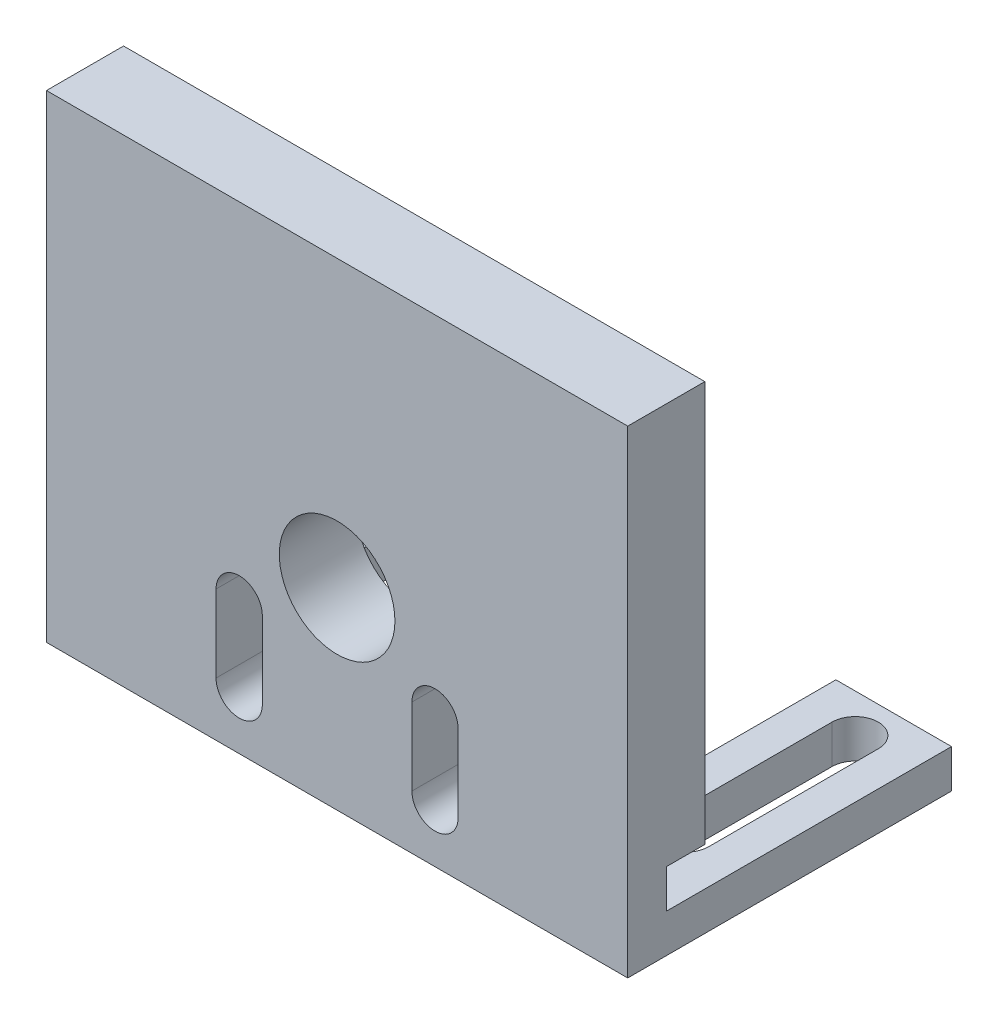
from build123d import *

# Parameters (mm, degrees)
SKETCH1_W           = 75.4
SKETCH1_H           = 62
SKETCH1_R           = 7.5
BOSS_EXTRUDE1_DEPTH = 10
SKETCH2_W           = 15
SKETCH2_H           = 32
BOSS_EXTRUDE2_DEPTH = 5
SKETCH3_W           = 15
SKETCH3_H           = 5
CUT_EXTRUDE1_DEPTH  = 5


with BuildPart() as part:
    # Sketch1 → Boss-Extrude1 (new body)
    with BuildSketch(Plane.XY):
        with Locations((0, 31)):
            Rectangle(SKETCH1_W, SKETCH1_H)
        with Locations((0, 25)):
            Circle(SKETCH1_R, mode=Mode.SUBTRACT)
        with BuildLine():
            Line((-9.7, 17), (-9.7, 7))
            ThreePointArc((-9.7, 7), (-12.7, 4), (-15.7, 7))
            Line((-15.7, 7), (-15.7, 17))
            ThreePointArc((-15.7, 17), (-12.7, 20), (-9.7, 17))
        make_face(mode=Mode.SUBTRACT)
        with BuildLine():
            Line((9.7, 17), (9.7, 7))
            ThreePointArc((9.7, 7), (12.7, 4), (15.7, 7))
            Line((15.7, 7), (15.7, 17))
            ThreePointArc((15.7, 17), (12.7, 20), (9.7, 17))
        make_face(mode=Mode.SUBTRACT)
    extrude(amount=BOSS_EXTRUDE1_DEPTH)

    # Sketch2 → Boss-Extrude2 (add)
    # profile 1 of 2: a face of its own
    with BuildSketch(Plane(origin=(0, 0, 0), x_dir=(1, 0, 0), z_dir=(0, 1, 0))):
        with Locations((-30.2, 16)):
            Rectangle(SKETCH2_W, SKETCH2_H)
        with BuildLine():
            Line((-27.2, 27), (-27.2, 5))
            ThreePointArc((-27.2, 5), (-30.2, 2), (-33.2, 5))
            Line((-33.2, 5), (-33.2, 27))
            ThreePointArc((-33.2, 27), (-30.2, 30), (-27.2, 27))
        make_face(mode=Mode.SUBTRACT)
    # profile 2 of 2: a face of its own
    with BuildSketch(Plane(origin=(0, 0, 0), x_dir=(1, 0, 0), z_dir=(0, 1, 0))):
        with Locations((30.2, 16)):
            Rectangle(SKETCH2_W, SKETCH2_H)
        with BuildLine():
            Line((27.2, 27), (27.2, 5))
            ThreePointArc((27.2, 5), (30.2, 2), (33.2, 5))
            Line((33.2, 5), (33.2, 27))
            ThreePointArc((33.2, 27), (30.2, 30), (27.2, 27))
        make_face(mode=Mode.SUBTRACT)
    extrude(amount=BOSS_EXTRUDE2_DEPTH)

    # Sketch3 → Cut-Extrude1 (cut)
    with BuildSketch(Plane.XY):
        with Locations((-30.2, 7.5)):
            Rectangle(SKETCH3_W, SKETCH3_H)
        with Locations((30.2, 7.5)):
            Rectangle(SKETCH3_W, SKETCH3_H)
    extrude(amount=CUT_EXTRUDE1_DEPTH, mode=Mode.SUBTRACT)


solid = part.part
